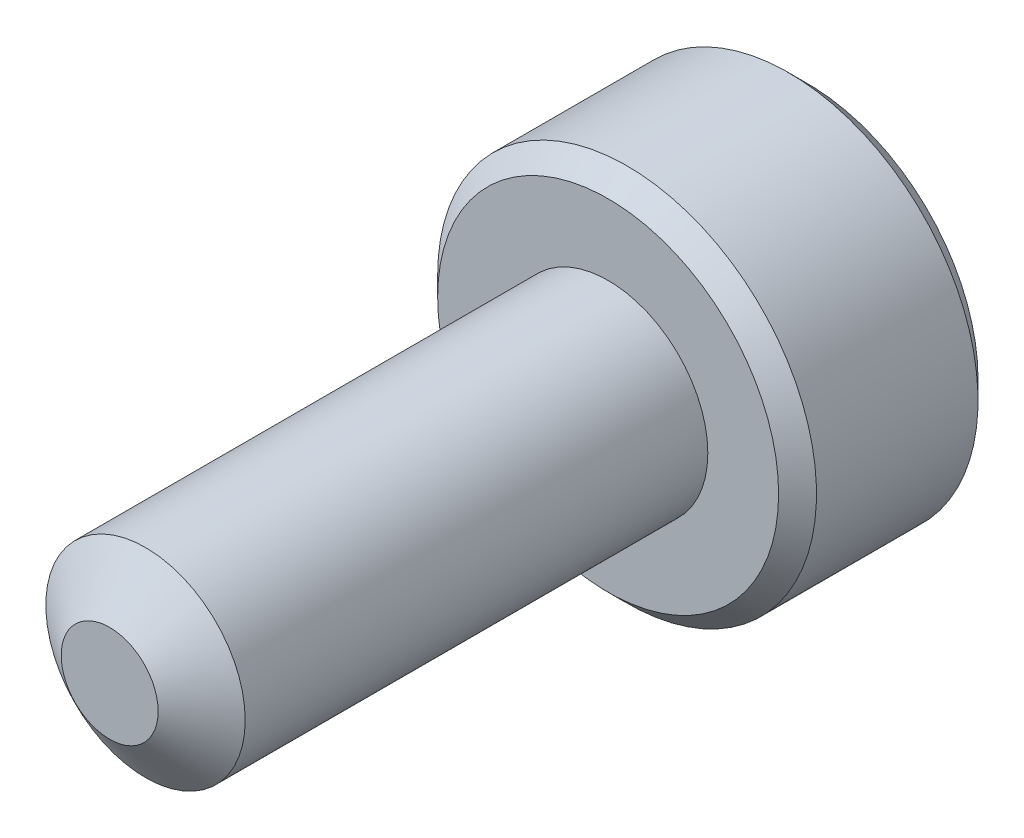
from build123d import *

# Parameters (mm, degrees)
SKETCH1_R          = 1
EXTRUDE1_DEPTH     = 5
SKETCH6_R          = 1.9
EXTRUDE2_DEPTH     = 2
CUT_EXTRUDE1_DEPTH = 1.125
CHAMFER1_SIZE      = 0.19


with BuildPart() as part:
    # Sketch1 → Extrude1 (new body)
    with BuildSketch(Plane.XY):
        Circle(SKETCH1_R)
    extrude(amount=-EXTRUDE1_DEPTH)

    # Sketch4 → Cut-Revolve1 (revolve, cut)
    with BuildSketch(Plane(origin=(0, 0, 0), x_dir=(0, 0, -1), z_dir=(1, 0, 0))):
        Polygon((0.35977197, 1), (0, 0.486192379), (0, 1), align=None)
    revolve(axis=Axis((0, 0, 0), (0, 0, -1)), mode=Mode.SUBTRACT)

    # Sketch6 → Extrude2 (add)
    with BuildSketch(Plane(origin=(0, 0, -5), x_dir=(-1, 0, 0), z_dir=(0, 0, -1))):
        Circle(SKETCH6_R)
    extrude(amount=EXTRUDE2_DEPTH)

    # Sketch7 → Cut-Extrude1 (cut)
    with BuildSketch(Plane(origin=(0, 0, -7), x_dir=(-1, 0, 0), z_dir=(0, 0, -1))):
        Polygon((0, 0.866025404), (-0.75, 0.433012702), (-0.75, -0.433012702), (0, -0.866025404), (0.75, -0.433012702), (0.75, 0.433012702), align=None)
    extrude(amount=-CUT_EXTRUDE1_DEPTH, mode=Mode.SUBTRACT)

    # Cut-Extrude2 cone 1 section (through the dimple's axis) → Cut-Extrude2 (revolve, cut)
    with BuildSketch(Plane(origin=(0, 0, -7), x_dir=(0, 1, 0), z_dir=(1, 0, 0))):
        Polygon((0, 0), (0.866025404, 0), (0, 0.866025404), align=None)
    revolve(axis=Axis((0, 0, -7), (0, 0, 1)), mode=Mode.SUBTRACT)

    # Chamfer1
    chamfer1_edges = [part.edges().sort_by_distance(p)[0] for p in [
        (1.9, 0, -7),
        (1.9, 0, -5),
    ]]
    chamfer(chamfer1_edges, length=CHAMFER1_SIZE)


solid = part.part
